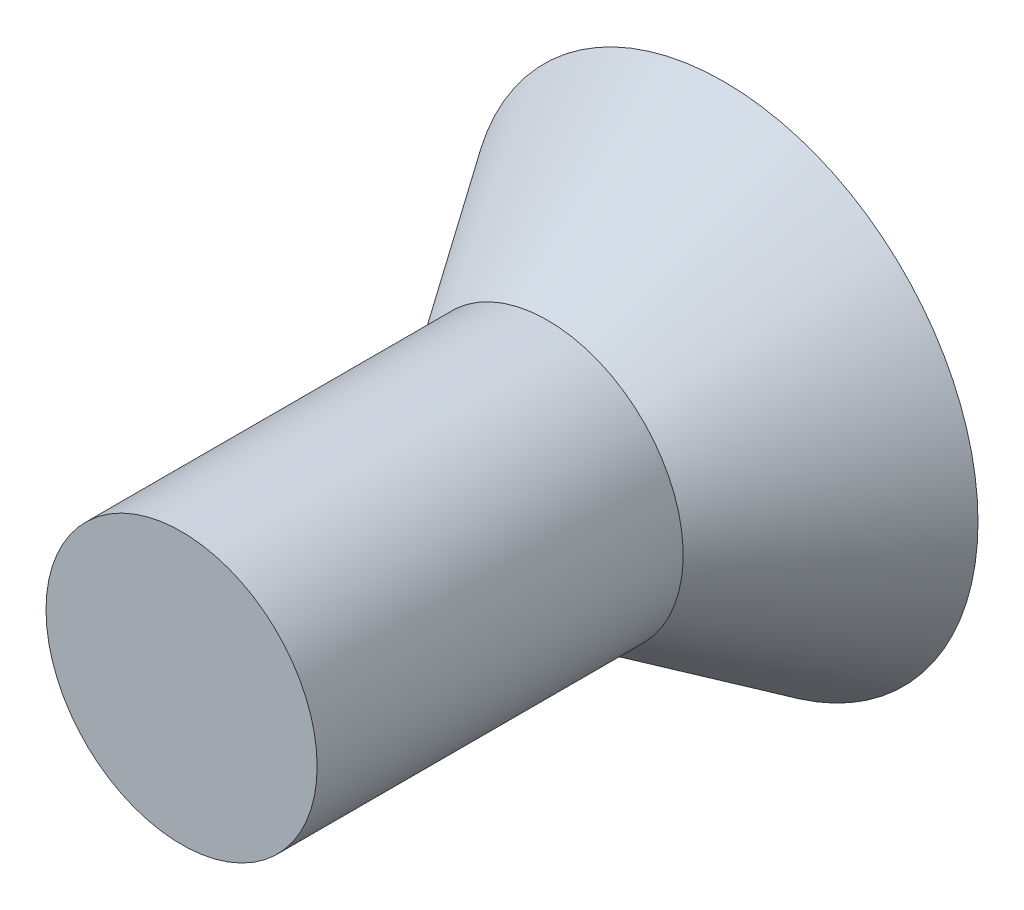
from build123d import *

# Parameters (mm, degrees)
SKETCH_1_R      = 2
EXTRUDE_1_DEPTH = 8


with BuildPart() as part:
    # 草图1 → 凸台-拉伸1 (new body)
    with BuildSketch(Plane.XY):
        Circle(SKETCH_1_R)
    extrude(amount=EXTRUDE_1_DEPTH)

    # 草图2 → 旋转1 (revolve)
    with BuildSketch(Plane(origin=(0, 0, 0), x_dir=(1, 0, 0), z_dir=(0, 1, 0)), mode=Mode.PRIVATE) as revolve_1_sk:
        Polygon((2, 0), (3.75, 0), (2, -2.6), align=None)
    revolve(revolve_1_sk.sketch.rotate(Axis((0, 0, 0), (0, 0, 1)), 180), axis=Axis((0, 0, 0), (0, 0, 1)))


solid = part.part
